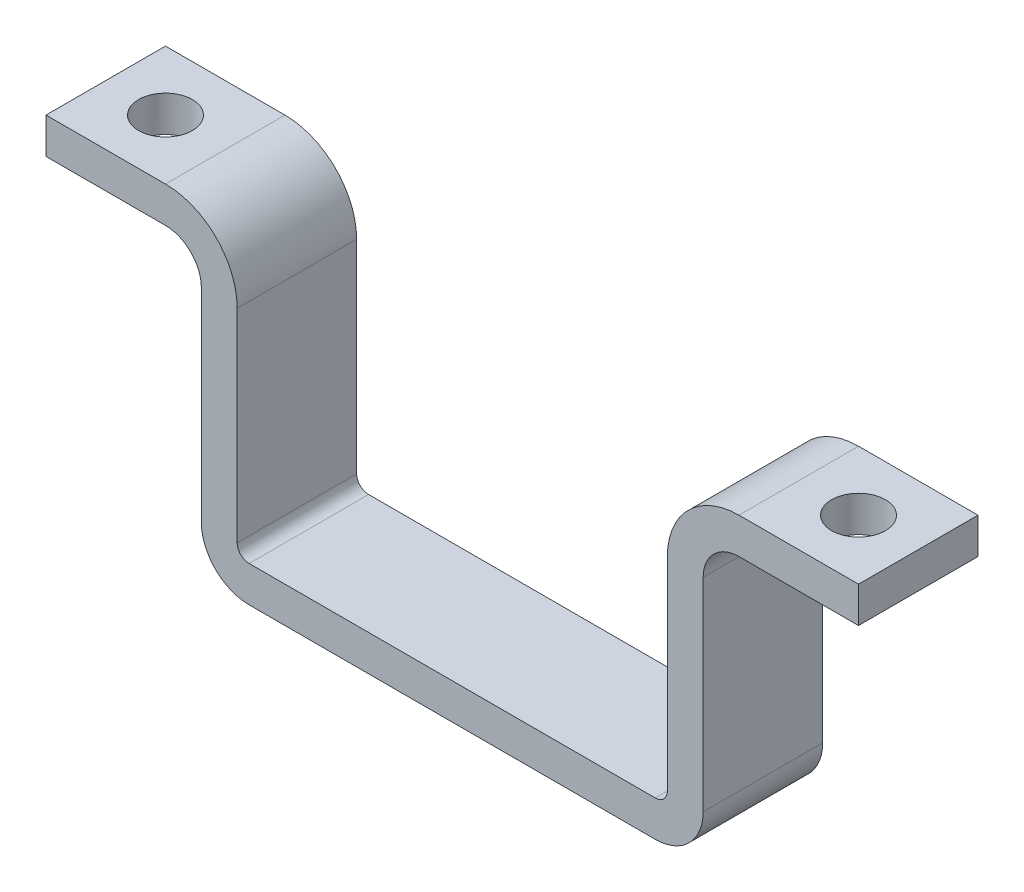
from build123d import *

# Parameters (mm, degrees)
BOSS_EXTRUDE1_DEPTH = 5
SKETCH2_R           = 2.25
CUT_EXTRUDE1_DEPTH  = 44.703546767


with BuildPart() as part:
    # Sketch1 → Boss-Extrude1 (new, symmetric)
    with BuildSketch(Plane.XY):
        with BuildLine():
            Line((-17, 0), (17, 0))
            ThreePointArc((17, 0), (17.707106781, 0.292893219), (18, 1))
            Line((18, 1), (18, 18))
            ThreePointArc((18, 18), (19.757359313, 22.242640687), (24, 24))
            Line((24, 24), (34, 24))
            Line((34, 24), (34, 21))
            Line((34, 21), (24, 21))
            ThreePointArc((24, 21), (21.878679656, 20.121320344), (21, 18))
            Line((21, 18), (21, 1))
            ThreePointArc((21, 1), (19.828427125, -1.828427125), (17, -3))
            Line((17, -3), (-17, -3))
            ThreePointArc((-17, -3), (-19.828427125, -1.828427125), (-21, 1))
            Line((-21, 1), (-21, 18))
            ThreePointArc((-21, 18), (-21.878679656, 20.121320344), (-24, 21))
            Line((-24, 21), (-34, 21))
            Line((-34, 21), (-34, 24))
            Line((-34, 24), (-24, 24))
            ThreePointArc((-24, 24), (-19.757359313, 22.242640687), (-18, 18))
            Line((-18, 18), (-18, 1))
            ThreePointArc((-18, 1), (-17.707106781, 0.292893219), (-17, 0))
        make_face()
    extrude(amount=BOSS_EXTRUDE1_DEPTH, both=True)

    # Sketch2 → Cut-Extrude1 (cut, through all)
    with BuildSketch(Plane(origin=(0, 24, 0), x_dir=(1, 0, 0), z_dir=(0, 1, 0))):
        with Locations(Location((-29, 0, 0), (0, 0, 180))):
            Circle(SKETCH2_R)
    cut_extrude1 = extrude(amount=-CUT_EXTRUDE1_DEPTH, mode=Mode.SUBTRACT)

    # Mirror1: Cut-Extrude1 across plane
    add(cut_extrude1.mirror(Plane(origin=(0, 0, 0), x_dir=(0, 0, 1), z_dir=(1, 0, 0))), mode=Mode.SUBTRACT)


solid = part.part
